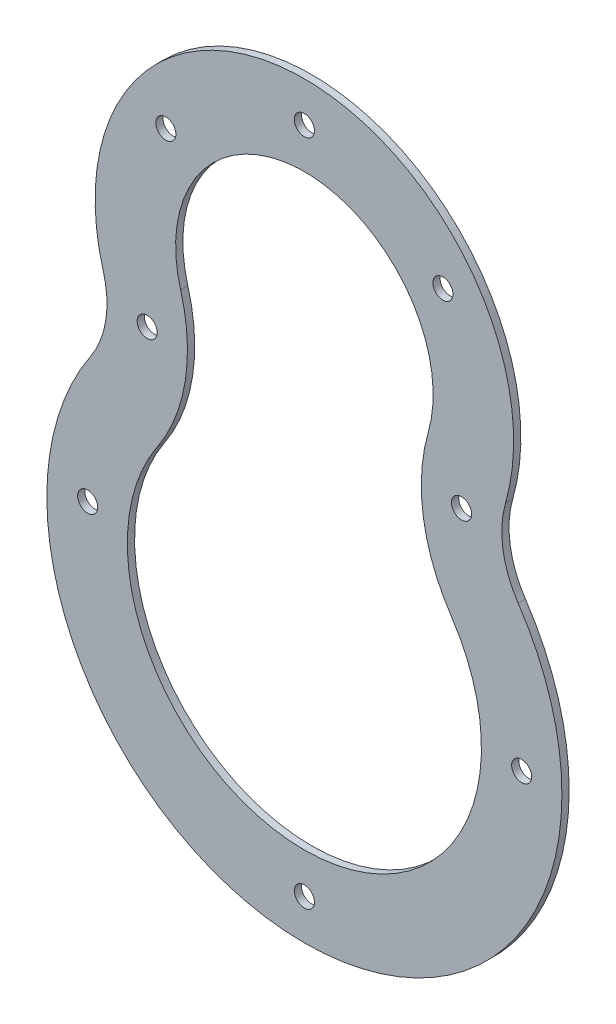
from build123d import *

# Parameters (mm, degrees)
BOSS_EXTRUDE1_DEPTH = 0.9
M3_TAPPED_HOLE1_D   = 2.5


with BuildPart() as part:
    # Sketch1 → Boss-Extrude1 (new body)
    with BuildSketch(Plane.XY):
        with BuildLine():
            ThreePointArc((-24.993351584, 27.835338346), (-24.67461016, 22.663230671), (-26.566359725, 17.838961039))
            ThreePointArc((-26.566359725, 17.838961039), (0, -32), (26.566359725, 17.838961039))
            ThreePointArc((26.566359725, 17.838961039), (24.67461016, 22.663230671), (24.993351584, 27.835338346))
            ThreePointArc((24.993351584, 27.835338346), (0, 61), (-24.993351584, 27.835338346))
        make_face()
        with BuildLine():
            ThreePointArc((-15.380524051, 30.590977444), (0, 51), (15.380524051, 30.590977444))
            ThreePointArc((15.380524051, 30.590977444), (14.796164774, 21.108780039), (18.264372311, 12.264285714))
            ThreePointArc((18.264372311, 12.264285714), (0, -22), (-18.264372311, 12.264285714))
            ThreePointArc((-18.264372311, 12.264285714), (-14.796164774, 21.108780039), (-15.380524051, 30.590977444))
        make_face(mode=Mode.SUBTRACT)
    extrude(amount=BOSS_EXTRUDE1_DEPTH)

    # M3 Tapped Hole1 (through all)
    with Locations(Plane.XY.offset(0.9)):
        with Locations((27, 0), (19.528744622, 24.528571429), (-19.528744622, 24.528571429), (-26.92368656, 2.028571429), (0, 56), (17.213758142, 47.028571429), (-17.213758142, 47.028571429), (0, -27)):
            Hole(M3_TAPPED_HOLE1_D / 2)


solid = part.part
